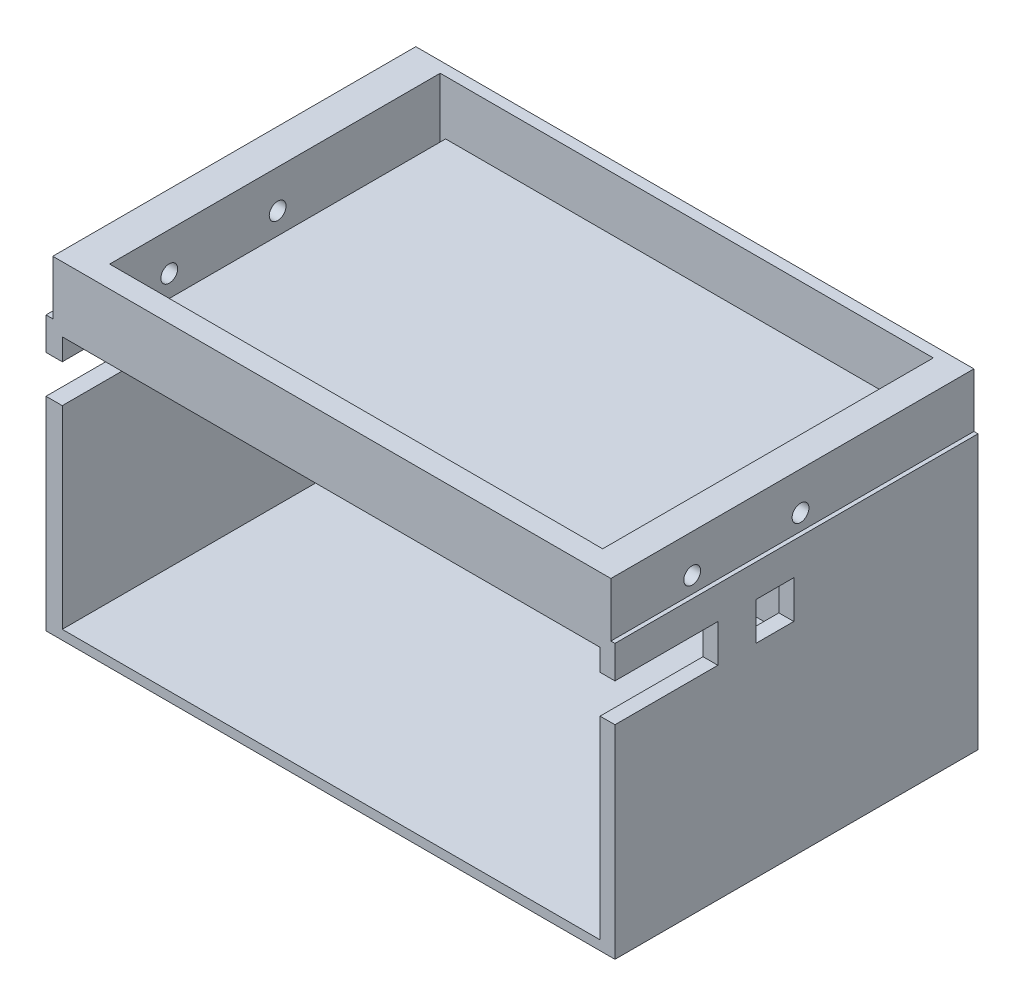
from build123d import *

# Parameters (mm, degrees)
SKETCH_1_W           = 99
SKETCH_1_H           = 65
EXTRUDE_1_DEPTH      = 2
EXTRUDE_2_DEPTH      = 46.5
EXTRUDE_2_DEPTH_BACK = 2
SKETCH_3_W           = 105
SKETCH_3_H           = 67
EXTRUDE_3_DEPTH      = 2
SKETCH_5_W           = 103
SKETCH_5_H           = 67
SKETCH_5_W_2         = 88
SKETCH_5_H_2         = 61
EXTRUDE_4_DEPTH      = 10
SKETCH_7_W           = 7
SKETCH_7_H           = 7
SKETCH_7_W_2         = 24.495718853
CUT_EXTRUDE_1_DEPTH  = 126.998015857
SKETCH_8_R           = 1.55
CUT_EXTRUDE_2_DEPTH  = 126.998015857
SKETCH_9_W           = 99.25
SKETCH_9_H           = 46.75
CUT_EXTRUDE_3_DEPTH  = 66
SKETCH_10_R          = 4
CUT_EXTRUDE_4_DEPTH  = 105.42940199
CUT_EXTRUDE_5_REACH  = 89.217
SKETCH_11_W          = 2
SKETCH_11_H          = 61.022672822
SKETCH_11_W_2        = 1
SKETCH_11_H_2        = 61


with BuildPart() as part:
    # 草图1 → 凸台-拉伸1 (new body)
    with BuildSketch(Plane(origin=(0, 0, 0), x_dir=(1, 0, 0), z_dir=(0, 1, 0))):
        Rectangle(SKETCH_1_W, SKETCH_1_H)
    extrude(amount=EXTRUDE_1_DEPTH)

    # 草图2 → 凸台-拉伸2 (add, two sides: drawn at the far end of the back side and taken through both)
    with BuildSketch(Plane(origin=(0, 2, 0), x_dir=(1, 0, 0), z_dir=(0, 1, 0)).offset(-EXTRUDE_2_DEPTH_BACK)):
        Polygon((-52.5, 34.5), (-52.5, -32.5), (-49.5, -32.5), (-49.5, 32.5), (49.5, 32.5), (49.5, -32.5), (52.5, -32.5), (52.5, 34.5), align=None)
    extrude(amount=EXTRUDE_2_DEPTH + EXTRUDE_2_DEPTH_BACK)

    # 草图3 → 凸台-拉伸3 (add)
    with BuildSketch(Plane(origin=(0, 48.5, 0), x_dir=(1, 0, 0), z_dir=(0, 1, 0))):
        with Locations((0, 1)):
            Rectangle(SKETCH_3_W, SKETCH_3_H)
    extrude(amount=EXTRUDE_3_DEPTH)

    # 草图5 → 凸台-拉伸4 (add)
    with BuildSketch(Plane(origin=(0, 50.5, 0), x_dir=(1, 0, 0), z_dir=(0, 1, 0))):
        with Locations((0.25, 1)):
            Rectangle(SKETCH_5_W, SKETCH_5_H)
        with Locations((0.25, 2)):
            Rectangle(SKETCH_5_W_2, SKETCH_5_H_2, mode=Mode.SUBTRACT)
    extrude(amount=EXTRUDE_4_DEPTH)

    # 草图7 → 切除-拉伸1 (cut, through all)
    with BuildSketch(Plane.ZY.offset(52.5)):
        with Locations((3, 41)):
            Rectangle(SKETCH_7_W, SKETCH_7_H)
        with Locations((25.747859426, 41)):
            Rectangle(SKETCH_7_W_2, SKETCH_7_H)
    extrude(amount=-CUT_EXTRUDE_1_DEPTH, mode=Mode.SUBTRACT)

    # 草图8 → 切除-拉伸2 (cut, through all)
    with BuildSketch(Plane.ZY.offset(52.5)):
        with Locations(Location((17.5, 53.5, 0), (0, 0, 180))):
            Circle(SKETCH_8_R)
        with Locations(Location((-2.5, 53.5, 0), (0, 0, 180))):
            Circle(SKETCH_8_R)
    extrude(amount=-CUT_EXTRUDE_2_DEPTH, mode=Mode.SUBTRACT)

    # 草图9 → 切除-拉伸3 (cut)
    with BuildSketch(Plane.XY.offset(32.5)):
        with Locations((0.125, 25.125)):
            Rectangle(SKETCH_9_W, SKETCH_9_H)
    extrude(amount=-CUT_EXTRUDE_3_DEPTH, mode=Mode.SUBTRACT)

    # 草图10 → 切除-拉伸4 (cut, through all)
    with BuildSketch(Plane.XY.offset(32.5)):
        with Locations((0, 21.301964842)):
            Circle(SKETCH_10_R)
    extrude(amount=-CUT_EXTRUDE_4_DEPTH, mode=Mode.SUBTRACT)

    # 草图11 → 切除-拉伸5 (cut, up to next)
    with BuildSketch(Plane(origin=(0, 60.5, 0), x_dir=(1, 0, 0), z_dir=(0, 1, 0)), mode=Mode.PRIVATE) as cut_extrude_5_sk1:
        with Locations((45.25, 1.988663589)):
            Rectangle(SKETCH_11_W, SKETCH_11_H)
    cut_extrude_5_tool1 = extrude(cut_extrude_5_sk1.sketch, amount=-CUT_EXTRUDE_5_REACH, mode=Mode.PRIVATE) & part.part
    # 草图11 → 切除-拉伸5 (cut, up to next)
    with BuildSketch(Plane(origin=(0, 60.5, 0), x_dir=(1, 0, 0), z_dir=(0, 1, 0)), mode=Mode.PRIVATE) as cut_extrude_5_sk2:
        with Locations((-44.25, 2)):
            Rectangle(SKETCH_11_W_2, SKETCH_11_H_2)
    cut_extrude_5_tool2 = extrude(cut_extrude_5_sk2.sketch, amount=-CUT_EXTRUDE_5_REACH, mode=Mode.PRIVATE) & part.part
    add(cut_extrude_5_tool1.solids().sort_by_distance((45.25, 60.5, -1.988664))[0], mode=Mode.SUBTRACT)
    add(cut_extrude_5_tool2.solids().sort_by_distance((-44.25, 60.5, -2))[0], mode=Mode.SUBTRACT)


solid = part.part
